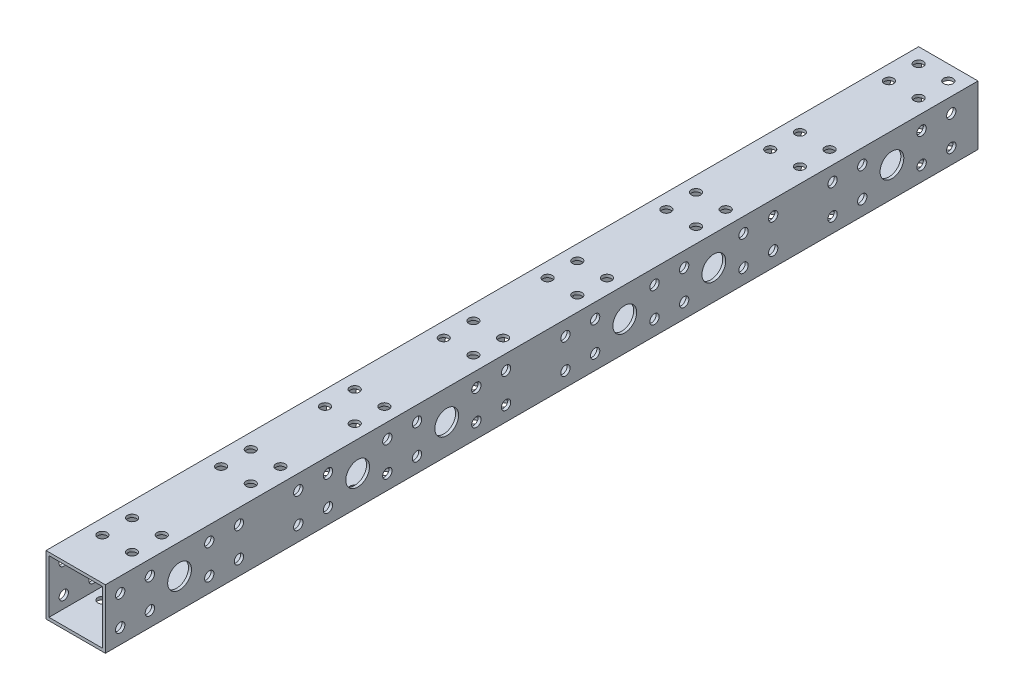
from build123d import *

# Parameters (mm, degrees)
SKETCH_1_W          = 20
SKETCH_1_H          = 20
SKETCH_1_W_2        = 18
SKETCH_1_H_2        = 18
EXTRUDE_1_DEPTH     = 294
SKETCH_2_R          = 1.575
SKETCH_2_R_2        = 4
CUT_EXTRUDE_1_DEPTH = 296.357410606
SKETCH_3_R          = 1.575
CUT_EXTRUDE_2_DEPTH = 296.357410606


with BuildPart() as part:
    # 草图1 → 拉伸-薄壁1 (new body)
    with BuildSketch(Plane.XY):
        with Locations((10, -10)):
            Rectangle(SKETCH_1_W, SKETCH_1_H)
        with Locations((10, -10)):
            Rectangle(SKETCH_1_W_2, SKETCH_1_H_2, mode=Mode.SUBTRACT)
    extrude(amount=EXTRUDE_1_DEPTH)

    # 草图2 → 切除-拉伸1 (cut, through all)
    with BuildSketch(Plane.ZY):
        with Locations(Location((289, -5, 0), (0, 0, 270))):
            Circle(SKETCH_2_R)
        with Locations(Location((289, -15, 0), (0, 0, 270))):
            Circle(SKETCH_2_R)
        with Locations(Location((279, -15, 0), (0, 0, 270))):
            Circle(SKETCH_2_R)
        with Locations(Location((279, -5, 0), (0, 0, 270))):
            Circle(SKETCH_2_R)
        with Locations(Location((259, -5, 0), (0, 0, 270))):
            Circle(SKETCH_2_R)
        with Locations(Location((259, -15, 0), (0, 0, 270))):
            Circle(SKETCH_2_R)
        with Locations(Location((249, -15, 0), (0, 0, 270))):
            Circle(SKETCH_2_R)
        with Locations(Location((249, -5, 0), (0, 0, 270))):
            Circle(SKETCH_2_R)
        with Locations(Location((229, -5, 0), (0, 0, 270))):
            Circle(SKETCH_2_R)
        with Locations(Location((229, -15, 0), (0, 0, 270))):
            Circle(SKETCH_2_R)
        with Locations(Location((219, -15, 0), (0, 0, 270))):
            Circle(SKETCH_2_R)
        with Locations(Location((219, -5, 0), (0, 0, 270))):
            Circle(SKETCH_2_R)
        with Locations(Location((199, -5, 0), (0, 0, 270))):
            Circle(SKETCH_2_R)
        with Locations(Location((199, -15, 0), (0, 0, 270))):
            Circle(SKETCH_2_R)
        with Locations(Location((189, -15, 0), (0, 0, 270))):
            Circle(SKETCH_2_R)
        with Locations(Location((189, -5, 0), (0, 0, 270))):
            Circle(SKETCH_2_R)
        with Locations(Location((169, -5, 0), (0, 0, 270))):
            Circle(SKETCH_2_R)
        with Locations(Location((169, -15, 0), (0, 0, 270))):
            Circle(SKETCH_2_R)
        with Locations(Location((159, -15, 0), (0, 0, 270))):
            Circle(SKETCH_2_R)
        with Locations(Location((159, -5, 0), (0, 0, 270))):
            Circle(SKETCH_2_R)
        with Locations(Location((139, -5, 0), (0, 0, 270))):
            Circle(SKETCH_2_R)
        with Locations(Location((139, -15, 0), (0, 0, 270))):
            Circle(SKETCH_2_R)
        with Locations(Location((129, -15, 0), (0, 0, 270))):
            Circle(SKETCH_2_R)
        with Locations(Location((129, -5, 0), (0, 0, 270))):
            Circle(SKETCH_2_R)
        with Locations(Location((109, -5, 0), (0, 0, 270))):
            Circle(SKETCH_2_R)
        with Locations(Location((109, -15, 0), (0, 0, 270))):
            Circle(SKETCH_2_R)
        with Locations(Location((99, -15, 0), (0, 0, 270))):
            Circle(SKETCH_2_R)
        with Locations(Location((99, -5, 0), (0, 0, 270))):
            Circle(SKETCH_2_R)
        with Locations(Location((79, -5, 0), (0, 0, 270))):
            Circle(SKETCH_2_R)
        with Locations(Location((79, -15, 0), (0, 0, 270))):
            Circle(SKETCH_2_R)
        with Locations(Location((69, -15, 0), (0, 0, 270))):
            Circle(SKETCH_2_R)
        with Locations(Location((69, -5, 0), (0, 0, 270))):
            Circle(SKETCH_2_R)
        with Locations(Location((49, -5, 0), (0, 0, 270))):
            Circle(SKETCH_2_R)
        with Locations(Location((49, -15, 0), (0, 0, 270))):
            Circle(SKETCH_2_R)
        with Locations(Location((39, -15, 0), (0, 0, 270))):
            Circle(SKETCH_2_R)
        with Locations(Location((39, -5, 0), (0, 0, 270))):
            Circle(SKETCH_2_R)
        with Locations(Location((19, -5, 0), (0, 0, 270))):
            Circle(SKETCH_2_R)
        with Locations(Location((19, -15, 0), (0, 0, 270))):
            Circle(SKETCH_2_R)
        with Locations(Location((9, -15, 0), (0, 0, 270))):
            Circle(SKETCH_2_R)
        with Locations(Location((9, -5, 0), (0, 0, 270))):
            Circle(SKETCH_2_R)
        with Locations(Location((269, -10, 0), (0, 0, 270))):
            Circle(SKETCH_2_R_2)
        with Locations(Location((209, -10, 0), (0, 0, 270))):
            Circle(SKETCH_2_R_2)
        with Locations(Location((179, -10, 0), (0, 0, 270))):
            Circle(SKETCH_2_R_2)
        with Locations(Location((119, -10, 0), (0, 0, 270))):
            Circle(SKETCH_2_R_2)
        with Locations(Location((89, -10, 0), (0, 0, 270))):
            Circle(SKETCH_2_R_2)
        with Locations(Location((29, -10, 0), (0, 0, 270))):
            Circle(SKETCH_2_R_2)
    extrude(amount=-CUT_EXTRUDE_1_DEPTH, mode=Mode.SUBTRACT)

    # 草图3 → 切除-拉伸2 (cut, through all)
    with BuildSketch(Plane(origin=(0, 0, 0), x_dir=(1, 0, 0), z_dir=(0, 1, 0))):
        with Locations(Location((5, -5, 0), (0, 0, 270))):
            Circle(SKETCH_3_R)
        with Locations(Location((15, -5, 0), (0, 0, 90))):
            Circle(SKETCH_3_R)
        with Locations(Location((15, -15, 0), (0, 0, 270))):
            Circle(SKETCH_3_R)
        with Locations(Location((5, -15, 0), (0, 0, 90))):
            Circle(SKETCH_3_R)
        with Locations(Location((5, -45, 0), (0, 0, 270))):
            Circle(SKETCH_3_R)
        with Locations(Location((15, -45, 0), (0, 0, 90))):
            Circle(SKETCH_3_R)
        with Locations(Location((15, -55, 0), (0, 0, 270))):
            Circle(SKETCH_3_R)
        with Locations(Location((5, -55, 0), (0, 0, 90))):
            Circle(SKETCH_3_R)
        with Locations(Location((5, -80, 0), (0, 0, 270))):
            Circle(SKETCH_3_R)
        with Locations(Location((15, -80, 0), (0, 0, 90))):
            Circle(SKETCH_3_R)
        with Locations(Location((5, -90, 0), (0, 0, 90))):
            Circle(SKETCH_3_R)
        with Locations(Location((15, -90, 0), (0, 0, 270))):
            Circle(SKETCH_3_R)
        with Locations(Location((5, -120, 0), (0, 0, 270))):
            Circle(SKETCH_3_R)
        with Locations(Location((5, -130, 0), (0, 0, 90))):
            Circle(SKETCH_3_R)
        with Locations(Location((15, -120, 0), (0, 0, 90))):
            Circle(SKETCH_3_R)
        with Locations(Location((15, -130, 0), (0, 0, 270))):
            Circle(SKETCH_3_R)
        with Locations(Location((5, -155, 0), (0, 0, 270))):
            Circle(SKETCH_3_R)
        with Locations(Location((15, -155, 0), (0, 0, 90))):
            Circle(SKETCH_3_R)
        with Locations(Location((5, -165, 0), (0, 0, 90))):
            Circle(SKETCH_3_R)
        with Locations(Location((15, -165, 0), (0, 0, 270))):
            Circle(SKETCH_3_R)
        with Locations(Location((5, -195, 0), (0, 0, 270))):
            Circle(SKETCH_3_R)
        with Locations(Location((5, -205, 0), (0, 0, 90))):
            Circle(SKETCH_3_R)
        with Locations(Location((15, -195, 0), (0, 0, 90))):
            Circle(SKETCH_3_R)
        with Locations(Location((15, -205, 0), (0, 0, 270))):
            Circle(SKETCH_3_R)
        with Locations(Location((5, -230, 0), (0, 0, 270))):
            Circle(SKETCH_3_R)
        with Locations(Location((15, -230, 0), (0, 0, 90))):
            Circle(SKETCH_3_R)
        with Locations(Location((5, -240, 0), (0, 0, 90))):
            Circle(SKETCH_3_R)
        with Locations(Location((15, -240, 0), (0, 0, 270))):
            Circle(SKETCH_3_R)
        with Locations(Location((5, -270, 0), (0, 0, 270))):
            Circle(SKETCH_3_R)
        with Locations(Location((5, -280, 0), (0, 0, 90))):
            Circle(SKETCH_3_R)
        with Locations(Location((15, -270, 0), (0, 0, 90))):
            Circle(SKETCH_3_R)
        with Locations(Location((15, -280, 0), (0, 0, 270))):
            Circle(SKETCH_3_R)
    extrude(amount=-CUT_EXTRUDE_2_DEPTH, mode=Mode.SUBTRACT)


solid = part.part
